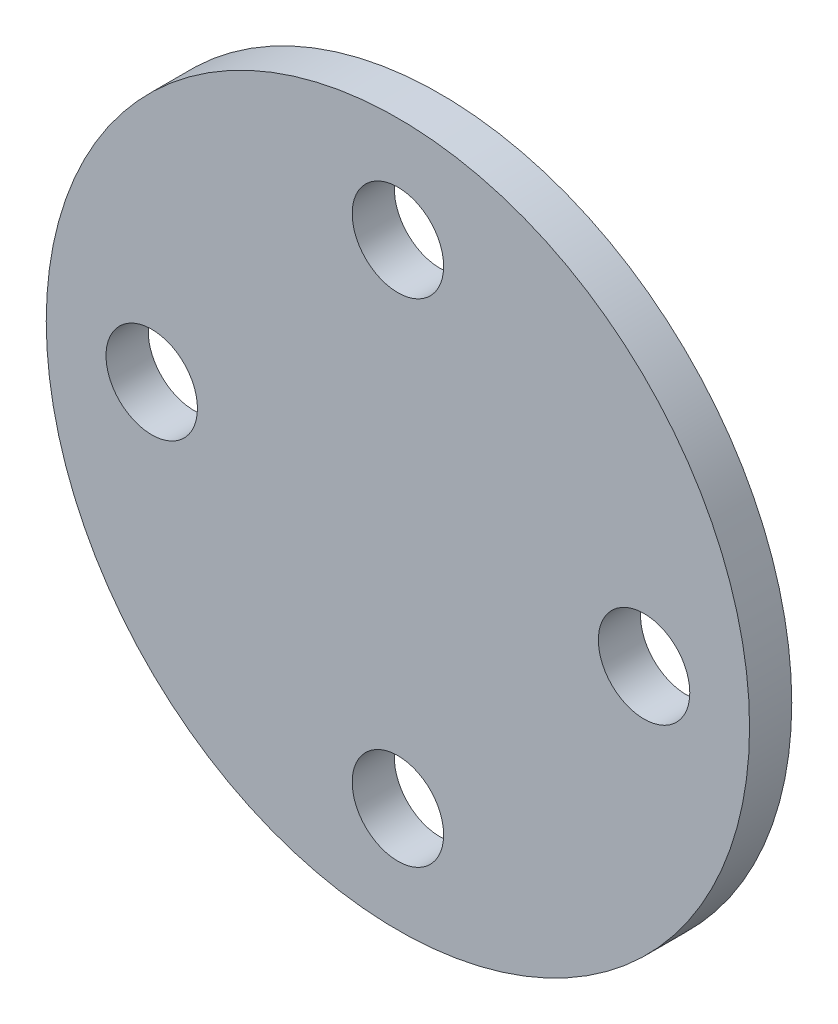
from build123d import *

# Parameters (mm, degrees)
SKETCH1_R           = 25
SKETCH1_R_2         = 3.25
BOSS_EXTRUDE2_DEPTH = 3


with BuildPart() as part:
    # Sketch1 → Boss-Extrude2 (new body)
    with BuildSketch(Plane.XY):
        Circle(SKETCH1_R)
        with Locations((0, 17.5)):
            Circle(SKETCH1_R_2, mode=Mode.SUBTRACT)
        with Locations((17.5, 0)):
            Circle(SKETCH1_R_2, mode=Mode.SUBTRACT)
        with Locations((0, -17.5)):
            Circle(SKETCH1_R_2, mode=Mode.SUBTRACT)
        with Locations((-17.5, 0)):
            Circle(SKETCH1_R_2, mode=Mode.SUBTRACT)
    extrude(amount=BOSS_EXTRUDE2_DEPTH)


solid = part.part
